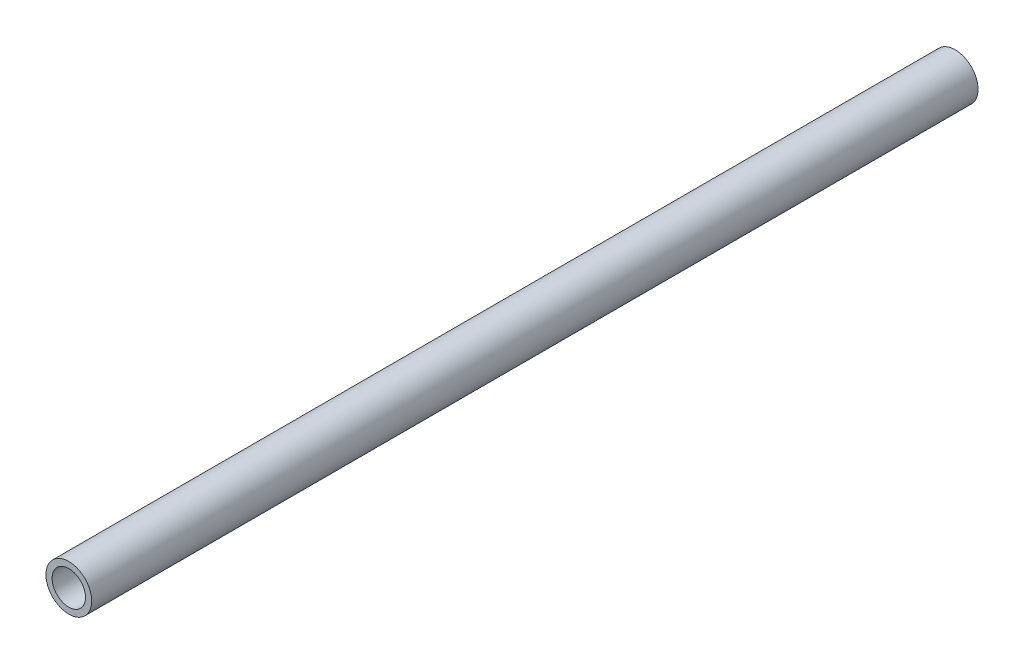
from build123d import *

# Parameters (mm, degrees)
CROQUIS1_R              = 10.7
CROQUIS1_R_2            = 7.825
SALIENTE_EXTRUIR1_DEPTH = 207.5


with BuildPart() as part:
    # Croquis1 → Saliente-Extruir1 (new, symmetric)
    with BuildSketch(Plane.XY):
        Circle(CROQUIS1_R)
        Circle(CROQUIS1_R_2, mode=Mode.SUBTRACT)
    extrude(amount=SALIENTE_EXTRUIR1_DEPTH, both=True)


solid = part.part
